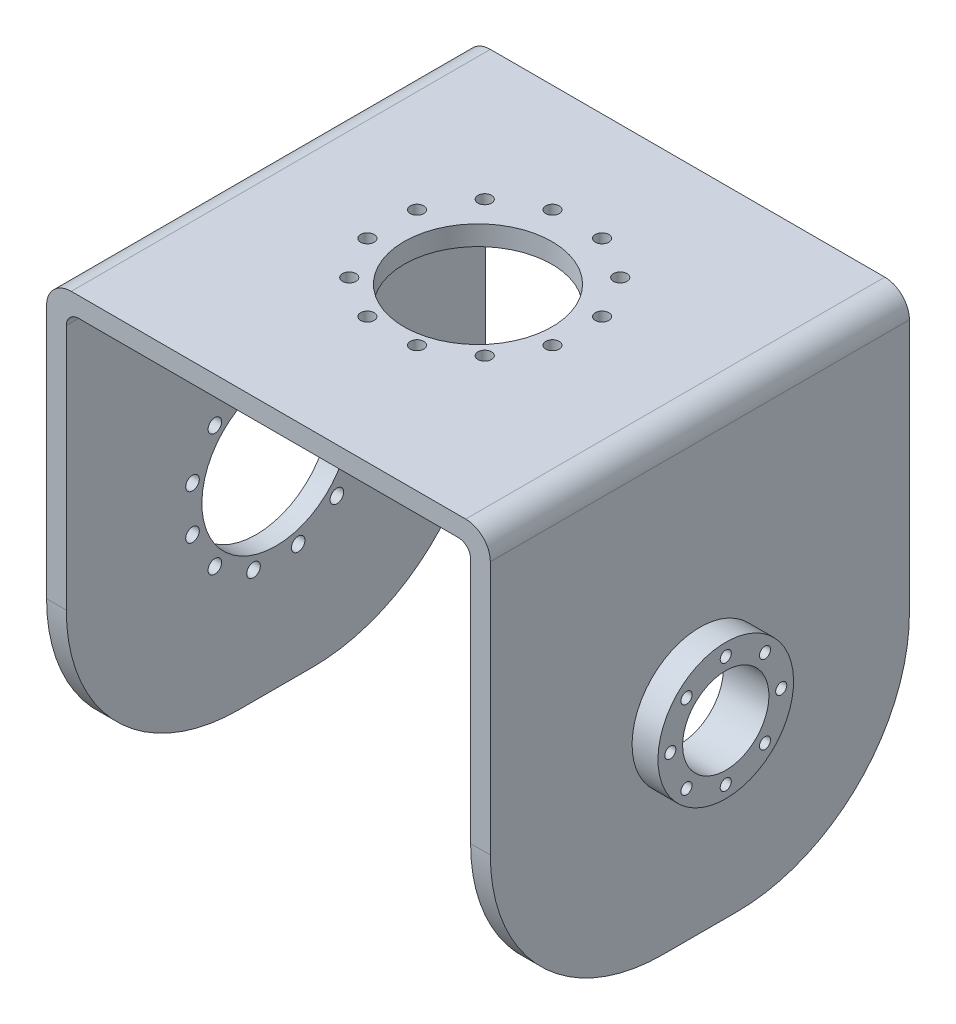
from build123d import *

# Parameters (mm, degrees)
EXTRUDE_1_DEPTH          = 170
SKETCH_2_R               = 30
CUT_EXTRUDE_1_DEPTH      = 180
CUT_EXTRUDE_2_DEPTH      = 304.191358716
CUT_EXTRUDE_2_DEPTH_BACK = 304.191358716
SKETCH_3_R               = 17.5
FILLET_1_R               = 70
FILLET_2_R               = 5
FILLET_3_R               = 10
SKETCH_6_R               = 30
CUT_EXTRUDE_6_DEPTH      = 39
SKETCH_12_R              = 2.75
CUT_EXTRUDE_12_DEPTH     = 10
EXTRUDE_START            = 10.5
SKETCH_14_R              = 27.5
SKETCH_14_R_2            = 17.5
EXTRUDE_2_DEPTH          = 10.5
SKETCH_13_R              = 2.25
CUT_EXTRUDE_13_DEPTH     = 15
SKETCH_15_R              = 2.75
CUT_EXTRUDE_14_DEPTH     = 10


with BuildPart() as part:
    # 草图1 → 凸台-拉伸1 (new body)
    with BuildSketch(Plane.XY):
        Polygon((-164, 0), (0, 0), (0, -175), (8, -175), (8, 8), (-164, 8), (-172, 8), (-172, -175), (-164, -175), align=None)
    extrude(amount=EXTRUDE_1_DEPTH)

    # 草图2 → 切除-拉伸1 (cut)
    with BuildSketch(Plane(origin=(0, 8, 0), x_dir=(1, 0, 0), z_dir=(0, 1, 0))):
        with Locations(Location((-82, -85, 0), (0, 0, 180))):
            Circle(SKETCH_2_R)
    extrude(amount=-CUT_EXTRUDE_1_DEPTH, mode=Mode.SUBTRACT)

    # 草图3 → 切除-拉伸2 (cut, two sides: drawn at the far end of the back side and taken through both)
    with BuildSketch(Plane(origin=(8, 0, 0), x_dir=(0, 0, -1), z_dir=(1, 0, 0)).offset(-CUT_EXTRUDE_2_DEPTH_BACK)):
        with Locations(Location((-85, -95, 0), (0, 0, 90))):
            Circle(SKETCH_3_R)
    extrude(amount=CUT_EXTRUDE_2_DEPTH + CUT_EXTRUDE_2_DEPTH_BACK, mode=Mode.SUBTRACT)

    # 圆角1
    fillet_1_edges = [part.edges().sort_by_distance(p)[0] for p in [
        (4, -175, 0),
        (4, -175, 170),
        (-168, -175, 170),
        (-168, -175, 0),
    ]]
    fillet(fillet_1_edges, radius=FILLET_1_R)

    # 圆角2
    fillet_2_edges = [part.edges().sort_by_distance(p)[0] for p in [
        (0, 0, 85),
        (-164, 0, 85),
    ]]
    fillet(fillet_2_edges, radius=FILLET_2_R)

    # 圆角3
    fillet_3_edges = [part.edges().sort_by_distance(p)[0] for p in [
        (-172, 8, 85),
        (8, 8, 85),
    ]]
    fillet(fillet_3_edges, radius=FILLET_3_R)

    # 草图6 → 切除-拉伸6 (cut)
    with BuildSketch(Plane.ZY.offset(172)):
        with Locations(Location((85, -95, 0), (0, 0, 270))):
            Circle(SKETCH_6_R)
    extrude(amount=-CUT_EXTRUDE_6_DEPTH, mode=Mode.SUBTRACT)

    # 草图12 → 切除-拉伸12 (cut)
    with BuildSketch(Plane.ZY.offset(172)):
        with Locations(Location((94.058666579, -128.80740392, 0), (0, 0, 270))):
            Circle(SKETCH_12_R)
        with Locations(Location((75.941333421, -128.80740392, 0), (0, 0, 270))):
            Circle(SKETCH_12_R)
        with Locations(Location((60.251262658, -119.748737342, 0), (0, 0, 270))):
            Circle(SKETCH_12_R)
        with Locations(Location((51.19259608, -104.058666579, 0), (0, 0, 270))):
            Circle(SKETCH_12_R)
        with Locations(Location((51.19259608, -85.941333421, 0), (0, 0, 270))):
            Circle(SKETCH_12_R)
        with Locations(Location((60.251262658, -70.251262658, 0), (0, 0, 270))):
            Circle(SKETCH_12_R)
        with Locations(Location((75.941333421, -61.19259608, 0), (0, 0, 270))):
            Circle(SKETCH_12_R)
        with Locations(Location((94.058666579, -61.19259608, 0), (0, 0, 270))):
            Circle(SKETCH_12_R)
        with Locations(Location((109.748737342, -70.251262658, 0), (0, 0, 270))):
            Circle(SKETCH_12_R)
        with Locations(Location((118.80740392, -85.941333421, 0), (0, 0, 270))):
            Circle(SKETCH_12_R)
        with Locations(Location((118.80740392, -104.058666579, 0), (0, 0, 270))):
            Circle(SKETCH_12_R)
        with Locations(Location((109.748737342, -119.748737342, 0), (0, 0, 270))):
            Circle(SKETCH_12_R)
    extrude(amount=-CUT_EXTRUDE_12_DEPTH, mode=Mode.SUBTRACT)

    # 草图14 → 凸台-拉伸2 (add)
    with BuildSketch(Plane(origin=(8, 0, 0), x_dir=(0, 0, -1), z_dir=(1, 0, 0)).offset(EXTRUDE_START)):
        with Locations(Location((-85, -95, 0), (0, 0, 270))):
            Circle(SKETCH_14_R)
        with Locations(Location((-85, -95, 0), (0, 0, 90))):
            Circle(SKETCH_14_R_2, mode=Mode.SUBTRACT)
    extrude(amount=-EXTRUDE_2_DEPTH)

    # 草图13 → 切除-拉伸13 (cut, symmetric)
    with BuildSketch(Plane(origin=(8, 0, 0), x_dir=(0, 0, -1), z_dir=(1, 0, 0))):
        with Locations(Location((-85, -72.5, 0), (0, 0, 90))):
            Circle(SKETCH_13_R)
        with Locations(Location((-69.090097423, -79.090097423, 0), (0, 0, 90))):
            Circle(SKETCH_13_R)
        with Locations(Location((-62.5, -95, 0), (0, 0, 90))):
            Circle(SKETCH_13_R)
        with Locations(Location((-69.090097423, -110.909902577, 0), (0, 0, 90))):
            Circle(SKETCH_13_R)
        with Locations(Location((-85, -117.5, 0), (0, 0, 90))):
            Circle(SKETCH_13_R)
        with Locations(Location((-100.909902577, -110.909902577, 0), (0, 0, 90))):
            Circle(SKETCH_13_R)
        with Locations(Location((-107.5, -95, 0), (0, 0, 90))):
            Circle(SKETCH_13_R)
        with Locations(Location((-100.909902577, -79.090097423, 0), (0, 0, 90))):
            Circle(SKETCH_13_R)
    extrude(amount=CUT_EXTRUDE_13_DEPTH, both=True, mode=Mode.SUBTRACT)

    # 草图15 → 切除-拉伸14 (cut)
    with BuildSketch(Plane(origin=(0, 8, 0), x_dir=(1, 0, 0), z_dir=(0, 1, 0))):
        with Locations(Location((-72.941333421, -118.80740392, 0), (0, 0, 270))):
            Circle(SKETCH_15_R)
        with Locations(Location((-93.058666579, -118.80740392, 0), (0, 0, 270))):
            Circle(SKETCH_15_R)
        with Locations(Location((-110.480788149, -108.748737342, 0), (0, 0, 270))):
            Circle(SKETCH_15_R)
        with Locations(Location((-120.539454728, -91.326615771, 0), (0, 0, 270))):
            Circle(SKETCH_15_R)
        with Locations(Location((-120.539454728, -71.209282614, 0), (0, 0, 270))):
            Circle(SKETCH_15_R)
        with Locations(Location((-110.480788149, -53.787161043, 0), (0, 0, 270))):
            Circle(SKETCH_15_R)
        with Locations(Location((-93.058666579, -43.728494465, 0), (0, 0, 270))):
            Circle(SKETCH_15_R)
        with Locations(Location((-72.941333421, -43.728494465, 0), (0, 0, 270))):
            Circle(SKETCH_15_R)
        with Locations(Location((-55.519211851, -53.787161043, 0), (0, 0, 270))):
            Circle(SKETCH_15_R)
        with Locations(Location((-45.460545272, -71.209282614, 0), (0, 0, 270))):
            Circle(SKETCH_15_R)
        with Locations(Location((-45.460545272, -91.326615771, 0), (0, 0, 270))):
            Circle(SKETCH_15_R)
        with Locations(Location((-55.519211851, -108.748737342, 0), (0, 0, 270))):
            Circle(SKETCH_15_R)
    extrude(amount=-CUT_EXTRUDE_14_DEPTH, mode=Mode.SUBTRACT)


solid = part.part
